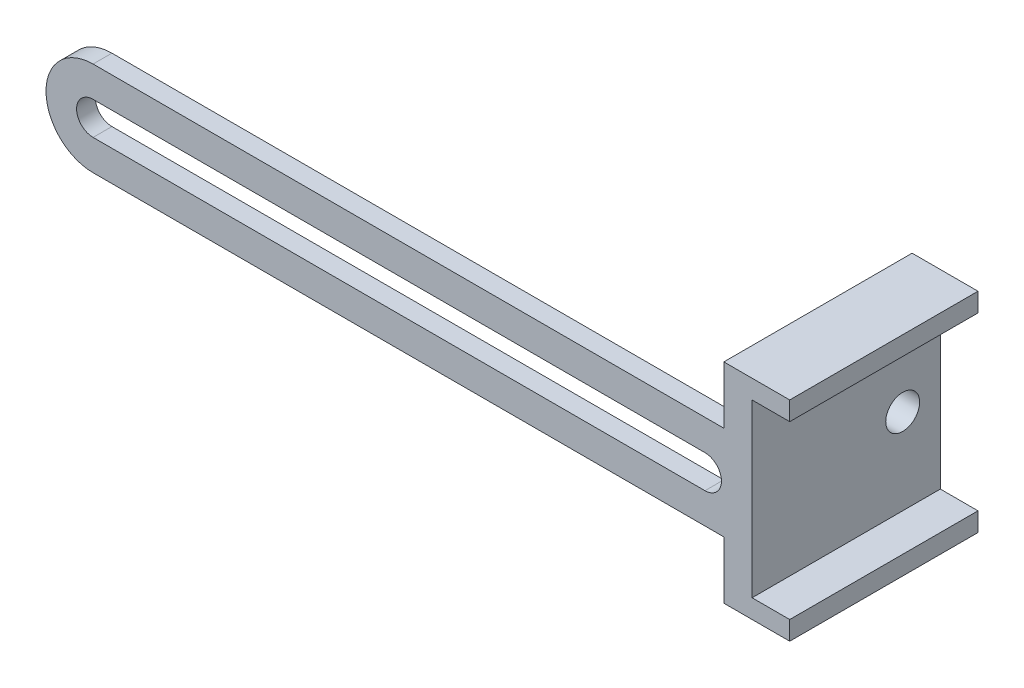
from build123d import *

# Parameters (mm, degrees)
BOSS_EXTRUDE1_DEPTH = 2
BOSS_EXTRUDE2_DEPTH = 20
SKETCH3_R           = 1.8
CUT_EXTRUDE1_DEPTH  = 15


with BuildPart() as part:
    # Sketch1 → Boss-Extrude1 (new body)
    with BuildSketch(Plane.XY):
        with BuildLine():
            Line((0, 5), (70, 5))
            Line((70, 5), (70, -5))
            Line((70, -5), (0, -5))
            ThreePointArc((0, -5), (-5, 0), (0, 5))
        make_face()
        with BuildLine():
            Line((0, 1.75), (65, 1.75))
            ThreePointArc((65, 1.75), (66.75, 0), (65, -1.75))
            Line((65, -1.75), (0, -1.75))
            ThreePointArc((0, -1.75), (-1.75, 0), (0, 1.75))
        make_face(mode=Mode.SUBTRACT)
    extrude(amount=-BOSS_EXTRUDE1_DEPTH)

    # Sketch2 → Boss-Extrude2 (add)
    with BuildSketch(Plane.XY):
        Polygon((74, 11.1), (67, 11.1), (67, -11.1), (74, -11.1), (74, -9.1), (70, -9.1), (70, 9.1), (74, 9.1), align=None)
    extrude(amount=-BOSS_EXTRUDE2_DEPTH)

    # Sketch3 → Cut-Extrude1 (cut)
    with BuildSketch(Plane.ZY.offset(-67)):
        with Locations((-16, 0)):
            Circle(SKETCH3_R)
    extrude(amount=-CUT_EXTRUDE1_DEPTH, mode=Mode.SUBTRACT)


solid = part.part
